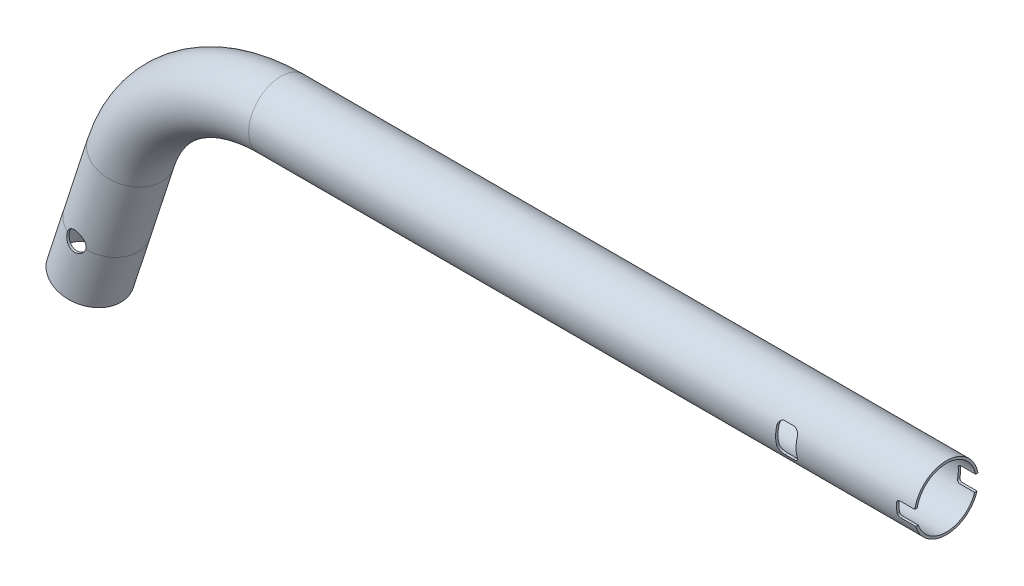
from build123d import *

# Parameters (mm, degrees)
SKETCH3_R               = 11
SKETCH3_R_2             = 10.2
CUT_EXTRUDE1_REACH      = 189.586
SKETCH4_R               = 3.3
SKETCH5_R               = 3.3
CUT_EXTRUDE2_DEPTH      = 188.586232712
CUT_EXTRUDE3_DEPTH      = 188.586232712
CUT_EXTRUDE3_DEPTH_BACK = 188.586232712


with BuildPart() as part:
    # Sweep2: sweep along a path in Sketch1
    with BuildLine(Plane.XY) as sweep2_path:
        Line((135.978349191, 0), (91.978349191, 0))
        Line((91.978349191, 0), (-91.978349191, 0))
        ThreePointArc((-91.978349191, 0), (-123.718752815, -10.313082304), (-143.335401071, -37.313082304))
        Line((-143.335401071, -37.313082304), (-151.421650809, -62.2))
        Line((-151.421650809, -62.2), (-157.205221402, -80))
    # Sketch3 → Sweep2 (sweep)
    with BuildSketch(Plane(origin=(91.978349191, 0, 0), x_dir=(0, 0, -1), z_dir=(1, 0, 0))):
        Circle(SKETCH3_R)
        Circle(SKETCH3_R_2, mode=Mode.SUBTRACT)
    sweep(path=sweep2_path.line)

    # Sketch4 → Cut-Extrude1 (cut, up to next)
    with BuildSketch(Plane.XY, mode=Mode.PRIVATE) as cut_extrude1_sk1:
        with Locations((-151.421650809, -62.2)):
            Circle(SKETCH4_R)
    cut_extrude1_tool1 = extrude(cut_extrude1_sk1.sketch, amount=CUT_EXTRUDE1_REACH, mode=Mode.PRIVATE) & part.part
    # Sketch4 → Cut-Extrude1 (cut, up to next)
    with BuildSketch(Plane.XY, mode=Mode.PRIVATE) as cut_extrude1_sk2:
        with BuildLine():
            Line((90.478349191, -5), (93.478349191, -5))
            ThreePointArc((93.478349191, -5), (94.892562753, -4.414213562), (95.478349191, -3))
            Line((95.478349191, -3), (95.478349191, 3))
            ThreePointArc((95.478349191, 3), (94.892562753, 4.414213562), (93.478349191, 5))
            Line((93.478349191, 5), (90.478349191, 5))
            ThreePointArc((90.478349191, 5), (89.064135629, 4.414213562), (88.478349191, 3))
            Line((88.478349191, 3), (88.478349191, -3))
            ThreePointArc((88.478349191, -3), (89.064135629, -4.414213562), (90.478349191, -5))
        make_face()
    cut_extrude1_tool2 = extrude(cut_extrude1_sk2.sketch, amount=CUT_EXTRUDE1_REACH, mode=Mode.PRIVATE) & part.part
    add(cut_extrude1_tool1.solids().sort_by_distance((-151.421651, -62.2, 0))[0], mode=Mode.SUBTRACT)
    add(cut_extrude1_tool2.solids().sort_by_distance((91.978349, 0, 0))[0], mode=Mode.SUBTRACT)

    # Sketch5 → Cut-Extrude2 (cut, through all)
    with BuildSketch(Plane.XY):
        with Locations((-151.421650809, -62.2)):
            Circle(SKETCH5_R)
    extrude(amount=-CUT_EXTRUDE2_DEPTH, mode=Mode.SUBTRACT)

    # Sketch6 → Cut-Extrude3 (cut, two sides: drawn at the far end of the back side and taken through both)
    with BuildSketch(Plane.XY.offset(-CUT_EXTRUDE3_DEPTH_BACK)):
        with BuildLine():
            Line((135.978349191, 1.950029185), (135.978349191, -3.249970815))
            Line((135.978349191, -3.249970815), (130.878349191, -3.249970815))
            ThreePointArc((130.878349191, -3.249970815), (130.17124241, -2.957077596), (129.878349191, -2.249970815))
            Line((129.878349191, -2.249970815), (129.878349191, 0.950029185))
            ThreePointArc((129.878349191, 0.950029185), (130.17124241, 1.657135966), (130.878349191, 1.950029185))
            Line((130.878349191, 1.950029185), (135.978349191, 1.950029185))
        make_face()
    extrude(amount=CUT_EXTRUDE3_DEPTH + CUT_EXTRUDE3_DEPTH_BACK, mode=Mode.SUBTRACT)


solid = part.part
